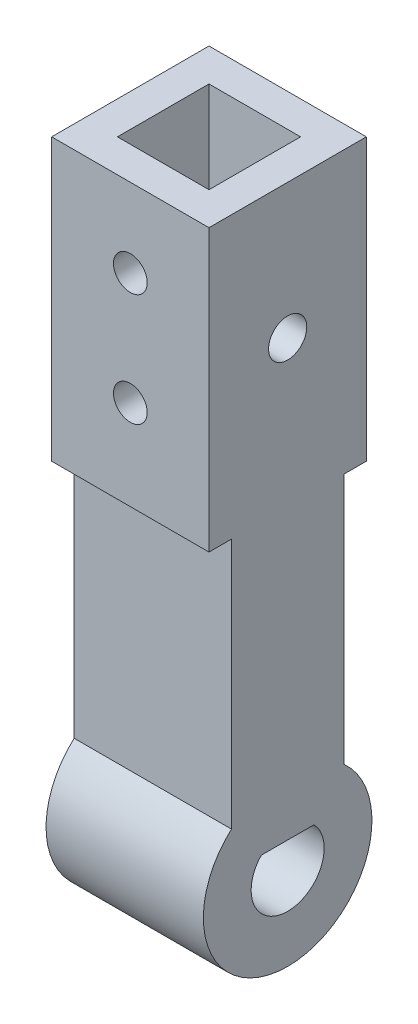
from build123d import *
from build123d.topology import SkipClean

# Parameters (mm, degrees)
BOSS_EXTRU_1_DEPTH      = 10
BOSS_EXTRU_2_DEPTH      = 15
CONG_1_R                = 20
CONG_2_R                = 4
ESQUISSE3_R             = 7.5
BOSS_EXTRU_3_DEPTH      = 10
ENL_V_MAT_EXTRU_1_DEPTH = 25
ESQUISSE11_W            = 14
ESQUISSE11_H            = 14
BOSS_EXTRU_4_DEPTH      = 25
ESQUISSE12_W            = 8.15
ESQUISSE12_H            = 8.15
ENL_V_MAT_EXTRU_4_DEPTH = 20
ENL_V_MAT_EXTRU_5_REACH = 58.169
ESQUISSE13_R            = 1.5
ENL_V_MAT_EXTRU_2_DEPTH = 20
ENL_V_MAT_EXTRU_6_REACH = 94.941
ESQUISSE15_R            = 1.5
D_GAGEMENT_M31_D        = 3.4
D_GAGEMENT_M31_DEPTH    = 10
D_GAGEMENT_M31_TIP      = 1.021463052
D_GAGEMENT_M32_D        = 3.4
D_GAGEMENT_M32_DEPTH    = 10
D_GAGEMENT_M32_TIP      = 1.021463052
BOSS_EXTRU_6_START      = 4
BOSS_EXTRU_6_DEPTH      = 4


with BuildPart() as part:
    # Esquisse1 → Boss.-Extru.1 (new body)
    with BuildSketch(Plane.XY):
        Polygon((65, 0), (65, 121.945008565), (0, 145.603073792), (3.420201433, 155), (70, 130.766935118), (136.579798567, 155), (140, 145.603073792), (75, 121.945008565), (75, 0), align=None)
    extrude(amount=BOSS_EXTRU_1_DEPTH)

    # Esquisse2 → Boss.-Extru.2 (add)
    with BuildSketch(Plane(origin=(0, 0, 0), x_dir=(-1, 0, 0), z_dir=(0, 0, -1))):
        Polygon((-135.301536896, 143.892973076), (-140, 145.603073792), (-136.579798567, 155), (-127.182872359, 151.579798567), (-128.892973076, 146.881335463), align=None)
        Polygon((0, 145.603073792), (-4.698463104, 143.892973076), (-11.107026924, 146.881335463), (-12.817127641, 151.579798567), (-3.420201433, 155), align=None)
    extrude(amount=BOSS_EXTRU_2_DEPTH)

    # Congé1
    cong_1_edges = [part.edges().sort_by_distance(p)[0] for p in [
        (65, 121.945008565, 5),
        (70, 130.766935118, 5),
        (75, 121.945008565, 5),
    ]]
    fillet(cong_1_edges, radius=CONG_1_R)

    # Congé2
    cong_2_edges = [part.edges().sort_by_distance(p)[0] for p in [
        (138.289899283, 150.301536896, 10),
        (1.710100717, 150.301536896, 10),
    ]]
    fillet(cong_2_edges, radius=CONG_2_R)

    # Esquisse3 → Boss.-Extru.3 (add)
    with BuildSketch(Plane.ZY.offset(-65)):
        with Locations((5, 0)):
            Circle(ESQUISSE3_R)
    extrude(amount=-BOSS_EXTRU_3_DEPTH)

    # Esquisse7 → Enlèv. mat.-Extru.1 (cut)
    with BuildSketch(Plane.XY.offset(10)):
        with BuildLine():
            Line((3.420201433, 155), (0, 145.603073792))
            Line((0, 145.603073792), (51.840402867, 126.734710216))
            ThreePointArc((51.840402867, 126.734710216), (61.383040886, 119.412386528), (65, 107.940857801))
            Line((65, 107.940857801), (65, 27.940857801))
            Line((65, 27.940857801), (75, 27.940857801))
            Line((75, 27.940857801), (75, 107.940857801))
            ThreePointArc((75, 107.940857801), (78.616959114, 119.412386528), (88.159597133, 126.734710216))
            Line((88.159597133, 126.734710216), (140, 145.603073792))
            Line((140, 145.603073792), (136.579798567, 155))
            Line((136.579798567, 155), (76.840402867, 133.256638152))
            ThreePointArc((76.840402867, 133.256638152), (70, 132.050490568), (63.159597133, 133.256638152))
            Line((63.159597133, 133.256638152), (3.420201433, 155))
        make_face()
    extrude(amount=-ENL_V_MAT_EXTRU_1_DEPTH, mode=Mode.SUBTRACT)

    # Esquisse11 → Boss.-Extru.4 (add)
    with BuildSketch(Plane(origin=(0, 27.940857801, 0), x_dir=(1, 0, 0), z_dir=(0, 1, 0))):
        with Locations((68, -5)):
            Rectangle(ESQUISSE11_W, ESQUISSE11_H)
    extrude(amount=BOSS_EXTRU_4_DEPTH)

    # Esquisse12 → Enlèv. mat.-Extru.4 (cut)
    with BuildSketch(Plane(origin=(0, 52.940857801, 0), x_dir=(1, 0, 0), z_dir=(0, 1, 0))):
        with Locations((68, -5)):
            Rectangle(ESQUISSE12_W, ESQUISSE12_H)
    extrude(amount=-ENL_V_MAT_EXTRU_4_DEPTH, mode=Mode.SUBTRACT)

    # Enlèv. mat.-Extru.5: up to this face of the body (flat: up to its plane)
    enl_v_mat_extru_5_end = Plane(part.part.faces().sort_by_distance((75, 24.172523414, 5))[0])
    # Esquisse13 → Enlèv. mat.-Extru.5 (cut, up to the picked face)
    with BuildSketch(Plane.ZY.offset(-61), mode=Mode.PRIVATE) as enl_v_mat_extru_5_sk1:
        with Locations(Location((5, 40.940857801, 0), (0, 0, 270))):
            Circle(ESQUISSE13_R)
    enl_v_mat_extru_5_tool1 = split(extrude(enl_v_mat_extru_5_sk1.sketch, amount=-ENL_V_MAT_EXTRU_5_REACH, mode=Mode.PRIVATE), bisect_by=enl_v_mat_extru_5_end, keep=Keep.BOTH, mode=Mode.PRIVATE)
    add(enl_v_mat_extru_5_tool1.solids().sort_by(Axis((61, 40.940858, 5), (1, 0, 0)))[0], mode=Mode.SUBTRACT)

    # Esquisse4 → Enlèv. mat.-Extru.2 (cut)
    with BuildSketch(Plane.ZY.offset(-65)):
        with BuildLine():
            Line((2.65479212, 2.25), (7.34520788, 2.25))
            ThreePointArc((7.34520788, 2.25), (5, -3.25), (2.65479212, 2.25))
        make_face()
    extrude(amount=-ENL_V_MAT_EXTRU_2_DEPTH, mode=Mode.SUBTRACT)

    # Enlèv. mat.-Extru.6: up to this face of the body (flat: up to its plane)
    enl_v_mat_extru_6_end = Plane(part.part.faces().sort_by_distance((68, 40.440857801, -2))[0])
    # Esquisse15 → Enlèv. mat.-Extru.6 (cut, up to the picked face)
    with BuildSketch(Plane.XY.offset(12), mode=Mode.PRIVATE) as enl_v_mat_extru_6_sk1:
        with Locations((68, 45.940857801)):
            Circle(ESQUISSE15_R)
    enl_v_mat_extru_6_tool1 = split(extrude(enl_v_mat_extru_6_sk1.sketch, amount=-ENL_V_MAT_EXTRU_6_REACH, mode=Mode.PRIVATE), bisect_by=enl_v_mat_extru_6_end, keep=Keep.BOTH, mode=Mode.PRIVATE)
    # Esquisse15 → Enlèv. mat.-Extru.6 (cut, up to the picked face)
    with BuildSketch(Plane.XY.offset(12), mode=Mode.PRIVATE) as enl_v_mat_extru_6_sk2:
        with Locations((68, 35.940857801)):
            Circle(ESQUISSE15_R)
    enl_v_mat_extru_6_tool2 = split(extrude(enl_v_mat_extru_6_sk2.sketch, amount=-ENL_V_MAT_EXTRU_6_REACH, mode=Mode.PRIVATE), bisect_by=enl_v_mat_extru_6_end, keep=Keep.BOTH, mode=Mode.PRIVATE)
    add(enl_v_mat_extru_6_tool1.solids().sort_by(Axis((68, 45.940858, 12), (0, 0, -1)))[0], mode=Mode.SUBTRACT)
    add(enl_v_mat_extru_6_tool2.solids().sort_by(Axis((68, 35.940858, 12), (0, 0, -1)))[0], mode=Mode.SUBTRACT)

    # Dégagement M31
    with Locations(Plane(origin=(0, 0, -2), x_dir=(-1, 0, 0), z_dir=(0, 0, -1))):
        with Locations((-68, 45.940857801), (-68, 35.940857801)):
            Hole(D_GAGEMENT_M31_D / 2, depth=D_GAGEMENT_M31_DEPTH)
            with Locations((0, 0, -(D_GAGEMENT_M31_DEPTH + D_GAGEMENT_M31_TIP / 2))):  # 118° drill point
                Cone(0, D_GAGEMENT_M31_D / 2, D_GAGEMENT_M31_TIP, mode=Mode.SUBTRACT)

    # Dégagement M32
    with Locations(Plane(origin=(75, 0, 0), x_dir=(0, 0, -1), z_dir=(1, 0, 0))):
        with Locations((-5, 40.940857801)):
            Hole(D_GAGEMENT_M32_D / 2, depth=D_GAGEMENT_M32_DEPTH)
            with Locations((0, 0, -(D_GAGEMENT_M32_DEPTH + D_GAGEMENT_M32_TIP / 2))):  # 118° drill point
                Cone(0, D_GAGEMENT_M32_D / 2, D_GAGEMENT_M32_TIP, mode=Mode.SUBTRACT)

    # Esquisse20 → Boss.-Extru.6 (add)
    with SkipClean():  # the faces are left unmerged after this step: merging them gives an invalid solid
        with BuildSketch(Plane.ZY.offset(-65).offset(BOSS_EXTRU_6_START)):
            with BuildLine():
                Line((10, 5.590169944), (10, 27.940857801))
                Line((10, 27.940857801), (0, 27.940857801))
                Line((0, 27.940857801), (0, 5.590169944))
                ThreePointArc((0, 5.590169944), (5, -7.5), (10, 5.590169944))
            make_face()
            with BuildLine():
                Line((7.34520788, 2.25), (2.65479212, 2.25))
                ThreePointArc((2.65479212, 2.25), (5, -3.25), (7.34520788, 2.25))
            make_face(mode=Mode.SUBTRACT)
        extrude(amount=-BOSS_EXTRU_6_DEPTH)


solid = part.part
